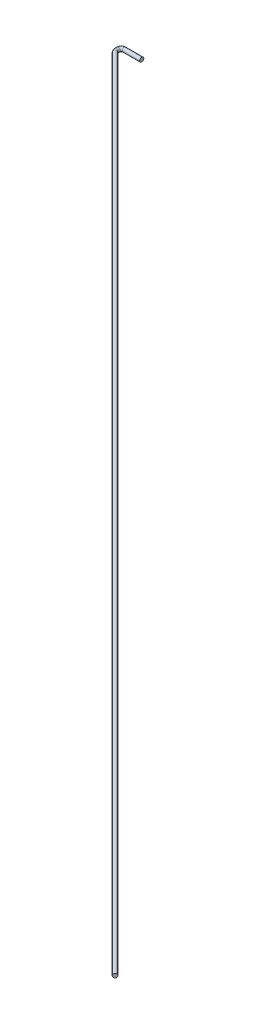
from build123d import *

# Parameters (mm, degrees)
SKETCH4_R = 1


with BuildPart() as part:
    # Sweep1: sweep along a path in Sketch1
    with BuildLine(Plane(origin=(0, 0, 0), x_dir=(1, 0, 0), z_dir=(0, 1, 0))) as sweep1_path:
        Line((10, 3), (1.5, 3))
        ThreePointArc((1.5, 3), (0.439339828, 2.560660172), (0, 1.5))
        Line((0, 1.5), (0, 0.621320344))
        ThreePointArc((0, 0.621320344), (0.114180701, 0.047295195), (0.439339828, -0.439339828))
        Line((0.439339828, -0.439339828), (390.817917962, -390.817917962))
    # Sketch4 → Sweep1 (sweep)
    with BuildSketch(Plane(origin=(10, 0, 0), x_dir=(0, 0, -1), z_dir=(1, 0, 0))):
        with Locations((3, 0)):
            Circle(SKETCH4_R)
    sweep(path=sweep1_path.line)


solid = part.part
